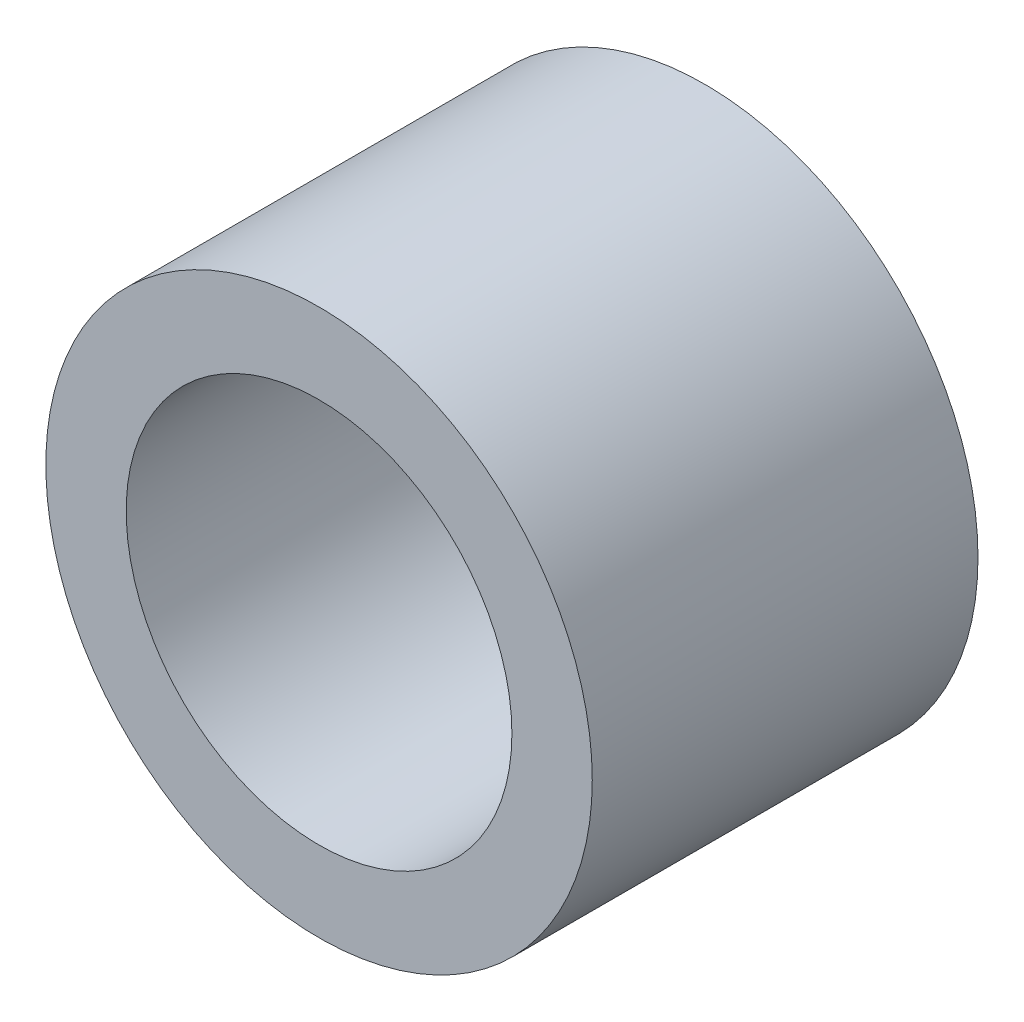
from build123d import *

# Parameters (mm, degrees)
SKETCH1_R           = 3.4
BOSS_EXTRUDE1_DEPTH = 0.8
SKETCH2_R           = 3.4
SKETCH2_R_2         = 2.4
BOSS_EXTRUDE2_DEPTH = 4


with BuildPart() as part:
    # Sketch1 → Boss-Extrude1 (new body)
    with BuildSketch(Plane.XY):
        Circle(SKETCH1_R)
    extrude(amount=BOSS_EXTRUDE1_DEPTH)

    # Sketch2 → Boss-Extrude2 (add)
    with BuildSketch(Plane.XY.offset(0.8)):
        Circle(SKETCH2_R)
        Circle(SKETCH2_R_2, mode=Mode.SUBTRACT)
    extrude(amount=BOSS_EXTRUDE2_DEPTH)


solid = part.part
